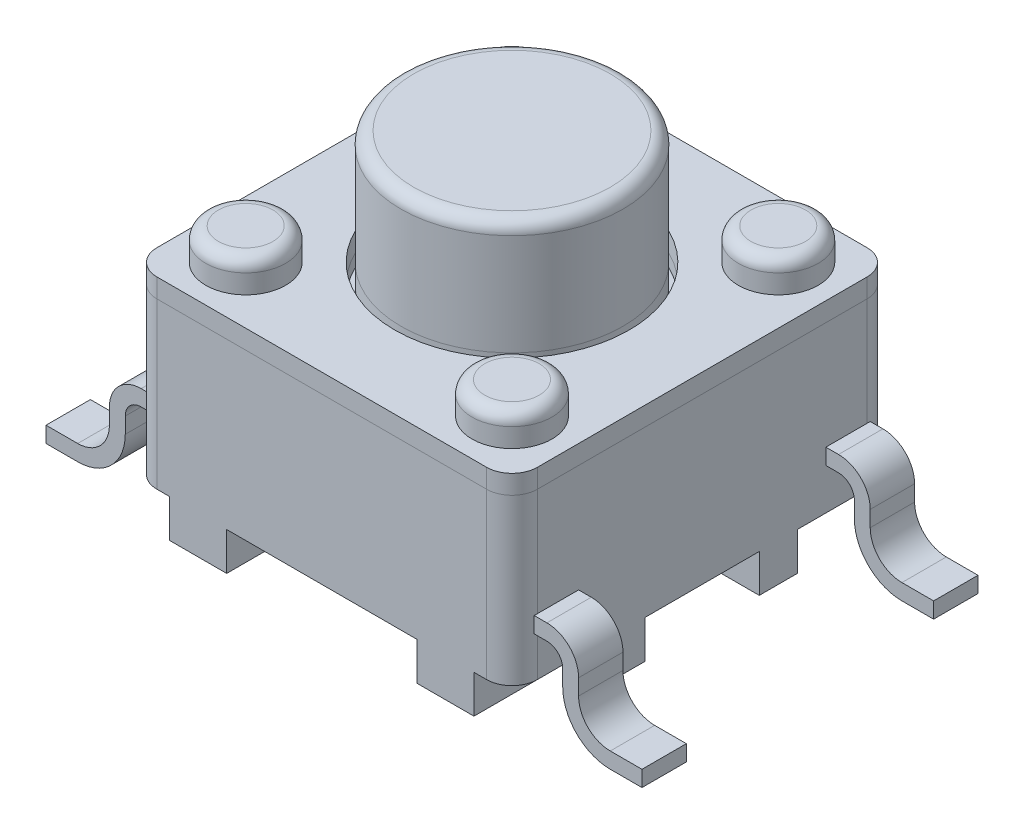
from build123d import *

# Parameters (mm, degrees)
EXTRUDE_1_DEPTH     = 0.6
EXTRUDE_1_2_DEPTH   = 0.6
SKETCH_2_W          = 6
SKETCH_2_H          = 6
EXTRUDE_2_DEPTH     = 2.9
EXTRUDE_START       = -0.35
EXTRUDE_1_3_DEPTH   = 0.7
SKETCH_5_R          = 1.75
EXTRUDE_3_DEPTH     = 1.8
SKETCH_6_R          = 0.63
EXTRUDE_4_DEPTH     = 0.5
EXTRUDE_4_2_DEPTH   = 0.5
EXTRUDE_4_3_DEPTH   = 0.5
EXTRUDE_4_4_DEPTH   = 0.5
FILLET_1_R          = 0.2
FILLET_2_R          = 0.2
FILLET_3_R          = 0.2
FILLET_4_R          = 0.2
FILLET_5_R          = 0.2
FILLET_6_R          = 0.4
SKETCH_7_R          = 1.85
SKETCH_7_R_2        = 1.75
CUT_EXTRUDE_1_DEPTH = 0.5
SKETCH_8_W          = 9.056297772
SKETCH_8_H          = 7.592045862


with BuildPart() as part:
    # Эскиз1 → Extrude 1 (new body)
    with BuildSketch(Plane(origin=(0, 0, 0), x_dir=(1, 0, 0), z_dir=(0, 1, 0))):
        Polygon((3, 0.9), (-3, 0.9), (-3, 1.5), (-2.4, 1.5), (-2.4, 3), (-1.5, 3), (-1.5, 1.5), (1.5, 1.5), (1.5, 3), (2.4, 3), (2.4, 1.5), (3, 1.5), align=None)
    extrude(amount=EXTRUDE_1_DEPTH)



with BuildPart() as body_2:
    # Эскиз1 → Extrude 1 2 (new body)
    with BuildSketch(Plane(origin=(0, 0, 0), x_dir=(1, 0, 0), z_dir=(0, 1, 0))):
        Polygon((1.5, -3), (1.5, -1.5), (-1.5, -1.5), (-1.5, -3), (-2.4, -3), (-2.4, -1.5), (-3, -1.5), (-3, -0.9), (3, -0.9), (3, -1.5), (2.4, -1.5), (2.4, -3), align=None)
    extrude(amount=EXTRUDE_1_2_DEPTH)


with BuildPart() as part_1:
    add(part.part)

    add(body_2.part)  # Бобышка-Вытянуть2 merges body 2
    # Эскиз2 → Бобышка-Вытянуть2 (add)
    with BuildSketch(Plane(origin=(0, 0.6, 0), x_dir=(1, 0, 0), z_dir=(0, 1, 0))):
        Rectangle(SKETCH_2_W, SKETCH_2_H)
    extrude(amount=EXTRUDE_2_DEPTH)

    # Скругление6
    fillet_6_edges = [part_1.edges().sort_by_distance(p)[0] for p in [
        (3, 2.05, 3),
        (3, 2.05, -3),
        (-3, 2.05, -3),
        (-3, 2.05, 3),
    ]]
    fillet(fillet_6_edges, radius=FILLET_6_R)

    # Эскиз7 → Вырез-Вытянуть1 (cut)
    with BuildSketch(Plane(origin=(0, 3.5, 0), x_dir=(1, 0, 0), z_dir=(0, 1, 0))):
        with Locations(Location((0, 0, 0), (0, 0, 270))):
            Circle(SKETCH_7_R)
        with Locations(Location((0, 0, 0), (0, 0, 270))):
            Circle(SKETCH_7_R_2, mode=Mode.SUBTRACT)
    extrude(amount=-CUT_EXTRUDE_1_DEPTH, mode=Mode.SUBTRACT)


with BuildPart() as body_2_2:
    # Эскиз4 → Extrude 1 3 (new body)
    with BuildSketch(Plane.XY.offset(3).offset(EXTRUDE_START)):
        with BuildLine():
            Line((3, 1.5), (3.2, 1.5))
            ThreePointArc((3.2, 1.5), (3.553553391, 1.353553391), (3.7, 1))
            Line((3.7, 1), (3.7, 0.75))
            ThreePointArc((3.7, 0.75), (3.846446609, 0.396446609), (4.2, 0.25))
            Line((4.2, 0.25), (4.7, 0.25))
            Line((4.7, 0.25), (4.7, 0))
            Line((4.7, 0), (4.2, 0))
            ThreePointArc((4.2, 0), (3.669669914, 0.219669914), (3.45, 0.75))
            Line((3.45, 0.75), (3.45, 1))
            ThreePointArc((3.45, 1), (3.376776695, 1.176776695), (3.2, 1.25))
            Line((3.2, 1.25), (3, 1.25))
            Line((3, 1.25), (3, 1.5))
        make_face()
    extrude(amount=-EXTRUDE_1_3_DEPTH)


with BuildPart() as body_3:
    # Зеркальное отражение1: mirrored copy
    add(body_2_2.part.mirror(Plane.XY))


with BuildPart() as body_4:
    # Зеркальное отражение2: mirrored copy
    add(body_2_2.part.mirror(Plane(origin=(0, 0, 0), x_dir=(0, 0, 1), z_dir=(1, 0, 0))))


with BuildPart() as body_5:
    # Mirror 2 2: mirrored copy
    add(body_3.part.mirror(Plane(origin=(0, 0, 0), x_dir=(0, 0, 1), z_dir=(1, 0, 0))))


with BuildPart() as body_6:
    # Эскиз5 → Бобышка-Вытянуть3 (new body)
    with BuildSketch(Plane(origin=(0, 3.5, 0), x_dir=(1, 0, 0), z_dir=(0, 1, 0))):
        with Locations(Location((0, 0, 0), (0, 0, 270))):
            Circle(SKETCH_5_R)
    extrude(amount=EXTRUDE_3_DEPTH)

    # Скругление5
    fillet_5_edges = [body_6.edges().sort_by_distance(p)[0] for p in [
        (0, 5.3, -1.75),
    ]]
    fillet(fillet_5_edges, radius=FILLET_5_R)


with BuildPart() as body_7:
    # Эскиз6 → Бобышка-Вытянуть4 (new body)
    with BuildSketch(Plane(origin=(0, 3.5, 0), x_dir=(1, 0, 0), z_dir=(0, 1, 0))):
        with Locations(Location((-2.1, 2.1, 0), (0, 0, 270))):
            Circle(SKETCH_6_R)
    extrude(amount=EXTRUDE_4_DEPTH)

    # Скругление3
    fillet_3_edges = [body_7.edges().sort_by_distance(p)[0] for p in [
        (-2.1, 4, -2.73),
    ]]
    fillet(fillet_3_edges, radius=FILLET_3_R)


with BuildPart() as body_8:
    # Эскиз6 → Extrude 4 2 (new body)
    with BuildSketch(Plane(origin=(0, 3.5, 0), x_dir=(1, 0, 0), z_dir=(0, 1, 0))):
        with Locations(Location((2.1, 2.1, 0), (0, 0, 270))):
            Circle(SKETCH_6_R)
    extrude(amount=EXTRUDE_4_2_DEPTH)

    # Скругление4
    fillet_4_edges = [body_8.edges().sort_by_distance(p)[0] for p in [
        (2.1, 4, -2.73),
    ]]
    fillet(fillet_4_edges, radius=FILLET_4_R)


with BuildPart() as body_9:
    # Эскиз6 → Extrude 4 3 (new body)
    with BuildSketch(Plane(origin=(0, 3.5, 0), x_dir=(1, 0, 0), z_dir=(0, 1, 0))):
        with Locations(Location((2.1, -2.1, 0), (0, 0, 270))):
            Circle(SKETCH_6_R)
    extrude(amount=EXTRUDE_4_3_DEPTH)

    # Скругление1
    fillet_1_edges = [body_9.edges().sort_by_distance(p)[0] for p in [
        (2.1, 4, 1.47),
    ]]
    fillet(fillet_1_edges, radius=FILLET_1_R)


with BuildPart() as body_10:
    # Эскиз6 → Extrude 4 4 (new body)
    with BuildSketch(Plane(origin=(0, 3.5, 0), x_dir=(1, 0, 0), z_dir=(0, 1, 0))):
        with Locations(Location((-2.1, -2.1, 0), (0, 0, 270))):
            Circle(SKETCH_6_R)
    extrude(amount=EXTRUDE_4_4_DEPTH)

    # Скругление2
    fillet_2_edges = [body_10.edges().sort_by_distance(p)[0] for p in [
        (-2.1, 4, 1.47),
    ]]
    fillet(fillet_2_edges, radius=FILLET_2_R)


with BuildPart() as body_11:
    # Split Bodies 1: the piece behind the surface
    add(part_1.part)
    # Эскиз8 → Sheet Plane 1: a flat surface bounded by the sketch
    with BuildSketch(Plane(origin=(0, 3.2, 0), x_dir=(1, 0, 0), z_dir=(0, 1, 0)), mode=Mode.PRIVATE) as sheet_plane_1_1_region:
        Rectangle(SKETCH_8_W, SKETCH_8_H)
    sheet_plane_1_1 = sheet_plane_1_1_region.sketch.faces()[0]
    split(bisect_by=sheet_plane_1_1, keep=Keep.BOTTOM)


with BuildPart() as part_2:
    add(part_1.part)

    # Split Bodies 1: split by a surface, the side it looks to stays
    # Эскиз8 → Sheet Plane 1: a flat surface bounded by the sketch
    with BuildSketch(Plane(origin=(0, 3.2, 0), x_dir=(1, 0, 0), z_dir=(0, 1, 0)), mode=Mode.PRIVATE) as sheet_plane_1_2_region:
        Rectangle(SKETCH_8_W, SKETCH_8_H)
    sheet_plane_1_2 = sheet_plane_1_2_region.sketch.faces()[0]
    split(bisect_by=sheet_plane_1_2, keep=Keep.TOP)


solid = Compound([body_2_2.part, body_3.part, body_4.part, body_5.part, body_6.part, body_7.part, body_8.part, body_9.part, body_10.part, body_11.part, part_2.part])
